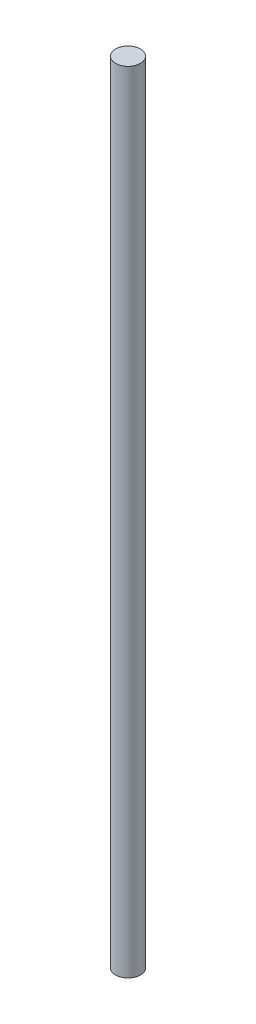
from build123d import *

# Parameters (mm, degrees)
OVEN_KESME_KILAVUZ_MILI_D12_2_START = 400
SKETCH1_R                           = 6
OVEN_KESME_KILAVUZ_MILI_D12_2_DEPTH = 380


with BuildPart() as part:
    # Sketch1 → OVEN_kesme_kilavuz_mili_D12_2 (new body)
    with BuildSketch(Plane(origin=(0, 0, 0), x_dir=(1, 0, 0), z_dir=(0, 1, 0)).offset(OVEN_KESME_KILAVUZ_MILI_D12_2_START)):
        with Locations(Location((550, 300, 0), (0, 0, 270))):
            Circle(SKETCH1_R)
    extrude(amount=OVEN_KESME_KILAVUZ_MILI_D12_2_DEPTH)


solid = part.part
